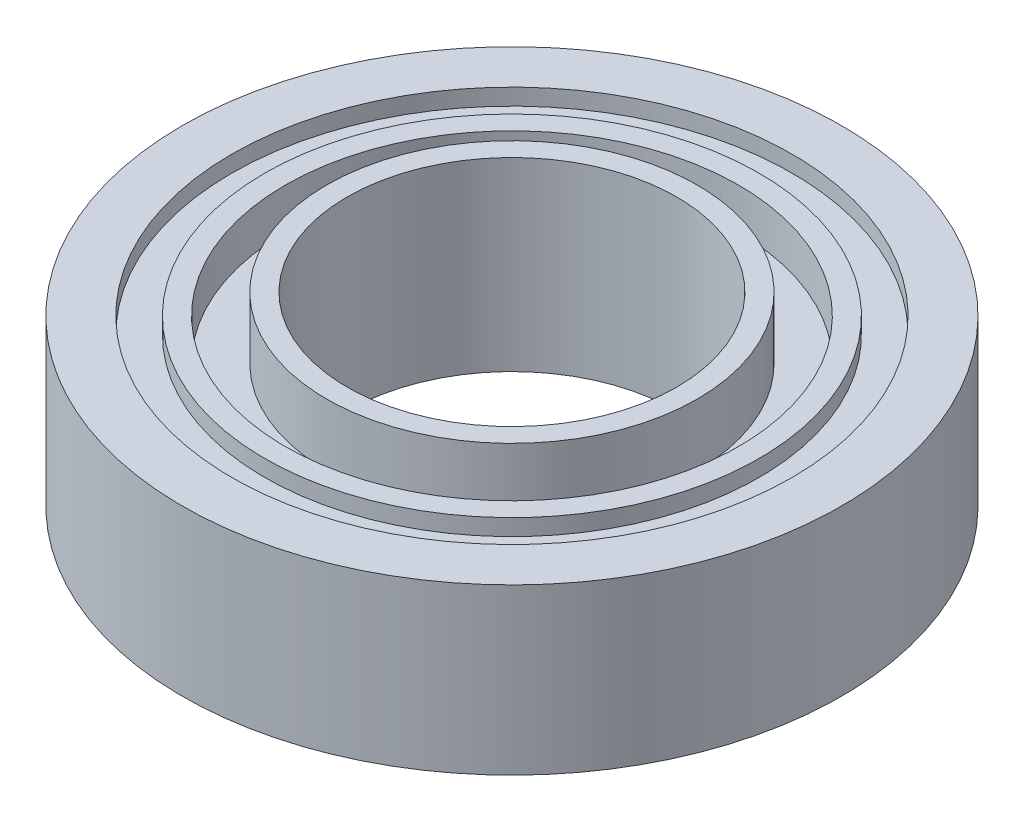
from build123d import *


with BuildPart() as part:
    # Sketch1 → Revolve1 (revolve)
    with BuildSketch(Plane.XY):
        Polygon((6.35, 25.4), (6.35, 12.7), (19.05, 12.7), (19.05, 25.4), (19.05, 31.75), (25.4, 31.75), (25.4, 25.4), (25.4, -25.4), (17.78, -25.4), (17.78, -20.32), (7.62, -20.32), (7.62, -25.4), (-25.4, -25.4), (-25.4, 25.4), (-10.16, 25.4), (-10.16, 20.32), (0, 20.32), (0, 25.4), align=None)
    revolve(axis=Axis((76.2, -1.30390901, 0), (0, -1, 0)))


solid = part.part
